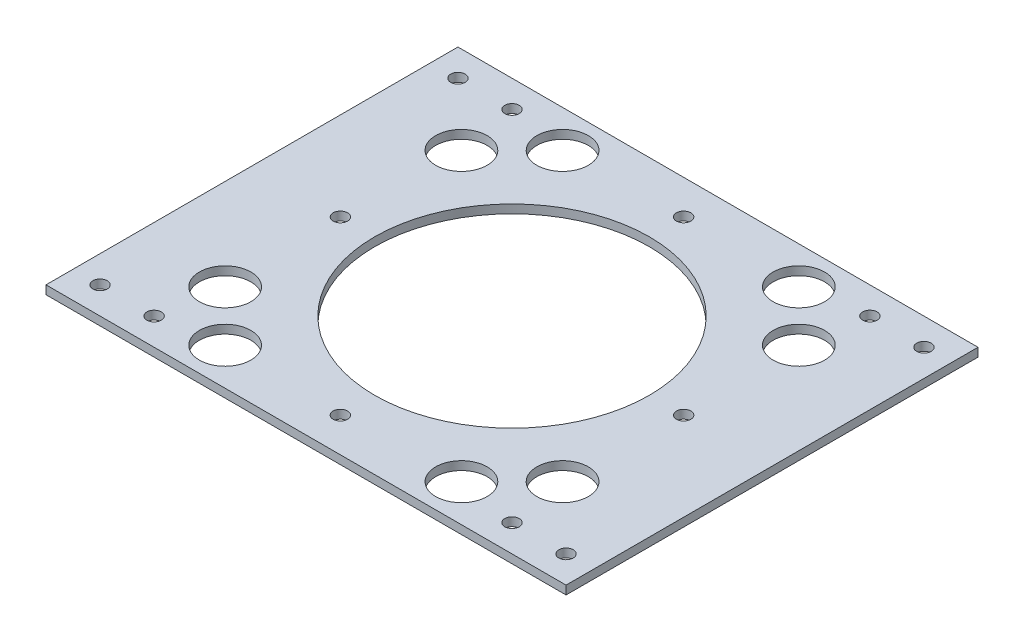
from build123d import *

# Parameters (mm, degrees)
SKETCH2_W           = 152.4
SKETCH2_H           = 152.4
SKETCH2_R           = 50.8
BOSS_EXTRUDE1_DEPTH = 3.175
CUT_EXTRUDE1_REACH  = 109.81
SKETCH3_R           = 2.665000004
CUT_EXTRUDE2_REACH  = 109.81
SKETCH4_R           = 9.525
CUT_EXTRUDE3_REACH  = 109.81
SKETCH5_R           = 2.665000004
SKETCH6_W           = 152.4
SKETCH6_H           = 3.175
BOSS_EXTRUDE2_DEPTH = 20
CUT_EXTRUDE4_REACH  = 124.764
SKETCH7_R           = 2.665000004


with BuildPart() as part:
    # Sketch2 → Boss-Extrude1 (new body)
    with BuildSketch(Plane(origin=(0, 0, 0), x_dir=(1, 0, 0), z_dir=(0, 1, 0))):
        Rectangle(SKETCH2_W, SKETCH2_H)
        with Locations(Location((0, 0, 0), (0, 0, 270))):
            Circle(SKETCH2_R, mode=Mode.SUBTRACT)
    extrude(amount=BOSS_EXTRUDE1_DEPTH)

    # Sketch3 → Cut-Extrude1 (cut, up to next)
    with BuildSketch(Plane(origin=(0, 3.175, 0), x_dir=(1, 0, 0), z_dir=(0, 1, 0)), mode=Mode.PRIVATE) as cut_extrude1_sk1:
        with Locations(Location((-66.2, -66.2, 0), (0, 0, 270))):
            Circle(SKETCH3_R)
    cut_extrude1_tool1 = extrude(cut_extrude1_sk1.sketch, amount=-CUT_EXTRUDE1_REACH, mode=Mode.PRIVATE) & part.part
    # Sketch3 → Cut-Extrude1 (cut, up to next)
    with BuildSketch(Plane(origin=(0, 3.175, 0), x_dir=(1, 0, 0), z_dir=(0, 1, 0)), mode=Mode.PRIVATE) as cut_extrude1_sk2:
        with Locations(Location((-66.2, 66.2, 0), (0, 0, 90))):
            Circle(SKETCH3_R)
    cut_extrude1_tool2 = extrude(cut_extrude1_sk2.sketch, amount=-CUT_EXTRUDE1_REACH, mode=Mode.PRIVATE) & part.part
    # Sketch3 → Cut-Extrude1 (cut, up to next)
    with BuildSketch(Plane(origin=(0, 3.175, 0), x_dir=(1, 0, 0), z_dir=(0, 1, 0)), mode=Mode.PRIVATE) as cut_extrude1_sk3:
        with Locations(Location((66.2, 66.2, 0), (0, 0, 270))):
            Circle(SKETCH3_R)
    cut_extrude1_tool3 = extrude(cut_extrude1_sk3.sketch, amount=-CUT_EXTRUDE1_REACH, mode=Mode.PRIVATE) & part.part
    # Sketch3 → Cut-Extrude1 (cut, up to next)
    with BuildSketch(Plane(origin=(0, 3.175, 0), x_dir=(1, 0, 0), z_dir=(0, 1, 0)), mode=Mode.PRIVATE) as cut_extrude1_sk4:
        with Locations(Location((66.2, -66.2, 0), (0, 0, 90))):
            Circle(SKETCH3_R)
    cut_extrude1_tool4 = extrude(cut_extrude1_sk4.sketch, amount=-CUT_EXTRUDE1_REACH, mode=Mode.PRIVATE) & part.part
    add(cut_extrude1_tool1.solids().sort_by_distance((-66.2, 3.175, 66.2))[0], mode=Mode.SUBTRACT)
    add(cut_extrude1_tool2.solids().sort_by_distance((-66.2, 3.175, -66.2))[0], mode=Mode.SUBTRACT)
    add(cut_extrude1_tool3.solids().sort_by_distance((66.2, 3.175, -66.2))[0], mode=Mode.SUBTRACT)
    add(cut_extrude1_tool4.solids().sort_by_distance((66.2, 3.175, 66.2))[0], mode=Mode.SUBTRACT)

    # Sketch4 → Cut-Extrude2 (cut, up to next)
    with BuildSketch(Plane(origin=(0, 3.175, 0), x_dir=(1, 0, 0), z_dir=(0, 1, 0)), mode=Mode.PRIVATE) as cut_extrude2_sk1:
        with Locations(Location((62.419385775, -43.70652445, 0), (0, 0, 270))):
            Circle(SKETCH4_R)
    cut_extrude2_tool1 = extrude(cut_extrude2_sk1.sketch, amount=-CUT_EXTRUDE2_REACH, mode=Mode.PRIVATE) & part.part
    # Sketch4 → Cut-Extrude2 (cut, up to next)
    with BuildSketch(Plane(origin=(0, 3.175, 0), x_dir=(1, 0, 0), z_dir=(0, 1, 0)), mode=Mode.PRIVATE) as cut_extrude2_sk2:
        with Locations(Location((43.70652445, -62.419385775, 0), (0, 0, 270))):
            Circle(SKETCH4_R)
    cut_extrude2_tool2 = extrude(cut_extrude2_sk2.sketch, amount=-CUT_EXTRUDE2_REACH, mode=Mode.PRIVATE) & part.part
    # Sketch4 → Cut-Extrude2 (cut, up to next)
    with BuildSketch(Plane(origin=(0, 3.175, 0), x_dir=(1, 0, 0), z_dir=(0, 1, 0)), mode=Mode.PRIVATE) as cut_extrude2_sk3:
        with Locations(Location((43.70652445, 62.419385775, 0), (0, 0, 90))):
            Circle(SKETCH4_R)
    cut_extrude2_tool3 = extrude(cut_extrude2_sk3.sketch, amount=-CUT_EXTRUDE2_REACH, mode=Mode.PRIVATE) & part.part
    # Sketch4 → Cut-Extrude2 (cut, up to next)
    with BuildSketch(Plane(origin=(0, 3.175, 0), x_dir=(1, 0, 0), z_dir=(0, 1, 0)), mode=Mode.PRIVATE) as cut_extrude2_sk4:
        with Locations(Location((62.419385775, 43.70652445, 0), (0, 0, 90))):
            Circle(SKETCH4_R)
    cut_extrude2_tool4 = extrude(cut_extrude2_sk4.sketch, amount=-CUT_EXTRUDE2_REACH, mode=Mode.PRIVATE) & part.part
    # Sketch4 → Cut-Extrude2 (cut, up to next)
    with BuildSketch(Plane(origin=(0, 3.175, 0), x_dir=(1, 0, 0), z_dir=(0, 1, 0)), mode=Mode.PRIVATE) as cut_extrude2_sk5:
        with Locations(Location((-43.70652445, 62.419385775, 0), (0, 0, 270))):
            Circle(SKETCH4_R)
    cut_extrude2_tool5 = extrude(cut_extrude2_sk5.sketch, amount=-CUT_EXTRUDE2_REACH, mode=Mode.PRIVATE) & part.part
    # Sketch4 → Cut-Extrude2 (cut, up to next)
    with BuildSketch(Plane(origin=(0, 3.175, 0), x_dir=(1, 0, 0), z_dir=(0, 1, 0)), mode=Mode.PRIVATE) as cut_extrude2_sk6:
        with Locations(Location((-62.419385775, 43.70652445, 0), (0, 0, 270))):
            Circle(SKETCH4_R)
    cut_extrude2_tool6 = extrude(cut_extrude2_sk6.sketch, amount=-CUT_EXTRUDE2_REACH, mode=Mode.PRIVATE) & part.part
    # Sketch4 → Cut-Extrude2 (cut, up to next)
    with BuildSketch(Plane(origin=(0, 3.175, 0), x_dir=(1, 0, 0), z_dir=(0, 1, 0)), mode=Mode.PRIVATE) as cut_extrude2_sk7:
        with Locations(Location((-43.70652445, -62.419385775, 0), (0, 0, 90))):
            Circle(SKETCH4_R)
    cut_extrude2_tool7 = extrude(cut_extrude2_sk7.sketch, amount=-CUT_EXTRUDE2_REACH, mode=Mode.PRIVATE) & part.part
    # Sketch4 → Cut-Extrude2 (cut, up to next)
    with BuildSketch(Plane(origin=(0, 3.175, 0), x_dir=(1, 0, 0), z_dir=(0, 1, 0)), mode=Mode.PRIVATE) as cut_extrude2_sk8:
        with Locations(Location((-62.419385775, -43.70652445, 0), (0, 0, 90))):
            Circle(SKETCH4_R)
    cut_extrude2_tool8 = extrude(cut_extrude2_sk8.sketch, amount=-CUT_EXTRUDE2_REACH, mode=Mode.PRIVATE) & part.part
    add(cut_extrude2_tool1.solids().sort_by_distance((62.419386, 3.175, 43.706524))[0], mode=Mode.SUBTRACT)
    add(cut_extrude2_tool2.solids().sort_by_distance((43.706524, 3.175, 62.419386))[0], mode=Mode.SUBTRACT)
    add(cut_extrude2_tool3.solids().sort_by_distance((43.706524, 3.175, -62.419386))[0], mode=Mode.SUBTRACT)
    add(cut_extrude2_tool4.solids().sort_by_distance((62.419386, 3.175, -43.706524))[0], mode=Mode.SUBTRACT)
    add(cut_extrude2_tool5.solids().sort_by_distance((-43.706524, 3.175, -62.419386))[0], mode=Mode.SUBTRACT)
    add(cut_extrude2_tool6.solids().sort_by_distance((-62.419386, 3.175, -43.706524))[0], mode=Mode.SUBTRACT)
    add(cut_extrude2_tool7.solids().sort_by_distance((-43.706524, 3.175, 62.419386))[0], mode=Mode.SUBTRACT)
    add(cut_extrude2_tool8.solids().sort_by_distance((-62.419386, 3.175, 43.706524))[0], mode=Mode.SUBTRACT)

    # Sketch5 → Cut-Extrude3 (cut, up to next)
    with BuildSketch(Plane(origin=(0, 3.175, 0), x_dir=(1, 0, 0), z_dir=(0, 1, 0)), mode=Mode.PRIVATE) as cut_extrude3_sk1:
        with Locations(Location((0, -63.5, 0), (0, 0, 270))):
            Circle(SKETCH5_R)
    cut_extrude3_tool1 = extrude(cut_extrude3_sk1.sketch, amount=-CUT_EXTRUDE3_REACH, mode=Mode.PRIVATE) & part.part
    # Sketch5 → Cut-Extrude3 (cut, up to next)
    with BuildSketch(Plane(origin=(0, 3.175, 0), x_dir=(1, 0, 0), z_dir=(0, 1, 0)), mode=Mode.PRIVATE) as cut_extrude3_sk2:
        with Locations(Location((-63.5, 0, 0), (0, 0, 270))):
            Circle(SKETCH5_R)
    cut_extrude3_tool2 = extrude(cut_extrude3_sk2.sketch, amount=-CUT_EXTRUDE3_REACH, mode=Mode.PRIVATE) & part.part
    # Sketch5 → Cut-Extrude3 (cut, up to next)
    with BuildSketch(Plane(origin=(0, 3.175, 0), x_dir=(1, 0, 0), z_dir=(0, 1, 0)), mode=Mode.PRIVATE) as cut_extrude3_sk3:
        with Locations(Location((0, 63.5, 0), (0, 0, 270))):
            Circle(SKETCH5_R)
    cut_extrude3_tool3 = extrude(cut_extrude3_sk3.sketch, amount=-CUT_EXTRUDE3_REACH, mode=Mode.PRIVATE) & part.part
    # Sketch5 → Cut-Extrude3 (cut, up to next)
    with BuildSketch(Plane(origin=(0, 3.175, 0), x_dir=(1, 0, 0), z_dir=(0, 1, 0)), mode=Mode.PRIVATE) as cut_extrude3_sk4:
        with Locations(Location((63.5, 0, 0), (0, 0, 270))):
            Circle(SKETCH5_R)
    cut_extrude3_tool4 = extrude(cut_extrude3_sk4.sketch, amount=-CUT_EXTRUDE3_REACH, mode=Mode.PRIVATE) & part.part
    add(cut_extrude3_tool1.solids().sort_by_distance((0, 3.175, 63.5))[0], mode=Mode.SUBTRACT)
    add(cut_extrude3_tool2.solids().sort_by_distance((-63.5, 3.175, 0))[0], mode=Mode.SUBTRACT)
    add(cut_extrude3_tool3.solids().sort_by_distance((0, 3.175, -63.5))[0], mode=Mode.SUBTRACT)
    add(cut_extrude3_tool4.solids().sort_by_distance((63.5, 3.175, 0))[0], mode=Mode.SUBTRACT)

    # Sketch6 → Boss-Extrude2 (add)
    with BuildSketch(Plane(origin=(76.2, 0, 0), x_dir=(0, 0, -1), z_dir=(1, 0, 0))):
        with Locations((0, 1.5875)):
            Rectangle(SKETCH6_W, SKETCH6_H)
    boss_extrude2 = extrude(amount=BOSS_EXTRUDE2_DEPTH)

    # Sketch7 → Cut-Extrude4 (cut, up to next)
    with BuildSketch(Plane(origin=(0, 3.175, 0), x_dir=(1, 0, 0), z_dir=(0, 1, 0)), mode=Mode.PRIVATE) as cut_extrude4_sk1:
        with Locations(Location((86.2, -66.2, 0), (0, 0, 270))):
            Circle(SKETCH7_R)
    cut_extrude4_tool1 = extrude(cut_extrude4_sk1.sketch, amount=-CUT_EXTRUDE4_REACH, mode=Mode.PRIVATE) & part.part
    # Sketch7 → Cut-Extrude4 (cut, up to next)
    with BuildSketch(Plane(origin=(0, 3.175, 0), x_dir=(1, 0, 0), z_dir=(0, 1, 0)), mode=Mode.PRIVATE) as cut_extrude4_sk2:
        with Locations(Location((86.2, 66.2, 0), (0, 0, 270))):
            Circle(SKETCH7_R)
    cut_extrude4_tool2 = extrude(cut_extrude4_sk2.sketch, amount=-CUT_EXTRUDE4_REACH, mode=Mode.PRIVATE) & part.part
    cut_extrude4_1 = cut_extrude4_tool1.solids().sort_by_distance((86.2, 3.175, 66.2))[0]
    add(cut_extrude4_1, mode=Mode.SUBTRACT)
    cut_extrude4_2 = cut_extrude4_tool2.solids().sort_by_distance((86.2, 3.175, -66.2))[0]
    add(cut_extrude4_2, mode=Mode.SUBTRACT)
    cut_extrude4 = cut_extrude4_1 + cut_extrude4_2  # Cut-Extrude4 as one shape, for the pattern or mirror that repeats it

    # Mirror1: Boss-Extrude2, Cut-Extrude4 across plane
    add(boss_extrude2.mirror(Plane(origin=(0, 0, 0), x_dir=(0, 0, 1), z_dir=(1, 0, 0))))
    add(cut_extrude4.mirror(Plane(origin=(0, 0, 0), x_dir=(0, 0, 1), z_dir=(1, 0, 0))), mode=Mode.SUBTRACT)


solid = part.part
